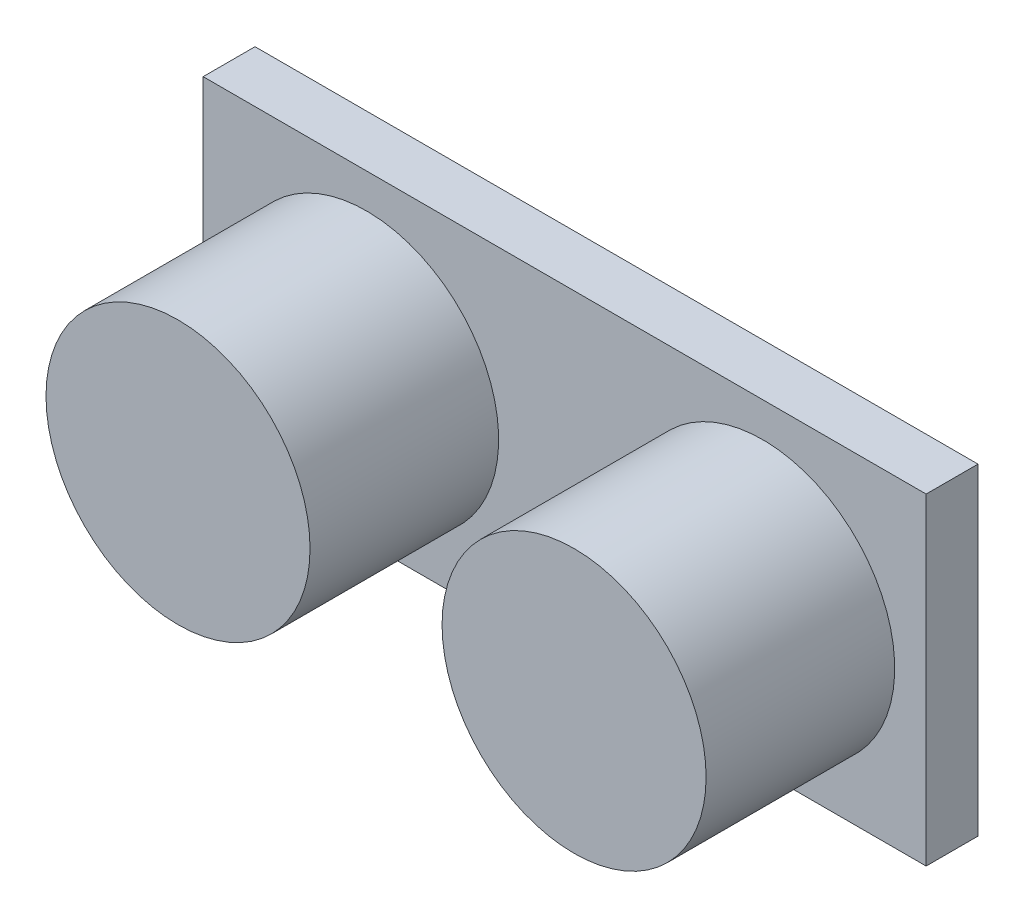
from build123d import *

# Parameters (mm, degrees)
SKETCH1_W           = 46
SKETCH1_H           = 20.5
BOSS_EXTRUDE1_DEPTH = 3.3
SKETCH2_R           = 8.4
BOSS_EXTRUDE2_DEPTH = 12
SKETCH3_W           = 10.3
SKETCH3_H           = 2.54
BOSS_EXTRUDE3_DEPTH = 2


with BuildPart() as part:
    # Sketch1 → Boss-Extrude1 (new body)
    with BuildSketch(Plane.XY):
        Rectangle(SKETCH1_W, SKETCH1_H)
    extrude(amount=BOSS_EXTRUDE1_DEPTH)

    # Sketch2 → Boss-Extrude2 (add)
    with BuildSketch(Plane.XY.offset(3.3)):
        with Locations(Location((-12.6, -0.35, 0), (0, 0, 180))):
            Circle(SKETCH2_R)
        with Locations(Location((12.6, -0.35, 0), (0, 0, 180))):
            Circle(SKETCH2_R)
    extrude(amount=BOSS_EXTRUDE2_DEPTH)

    # Sketch3 → Boss-Extrude3 (add)
    with BuildSketch(Plane(origin=(0, 0, 0), x_dir=(-1, 0, 0), z_dir=(0, 0, -1))):
        with Locations((0, -8.98)):
            Rectangle(SKETCH3_W, SKETCH3_H)
    extrude(amount=BOSS_EXTRUDE3_DEPTH)


solid = part.part
